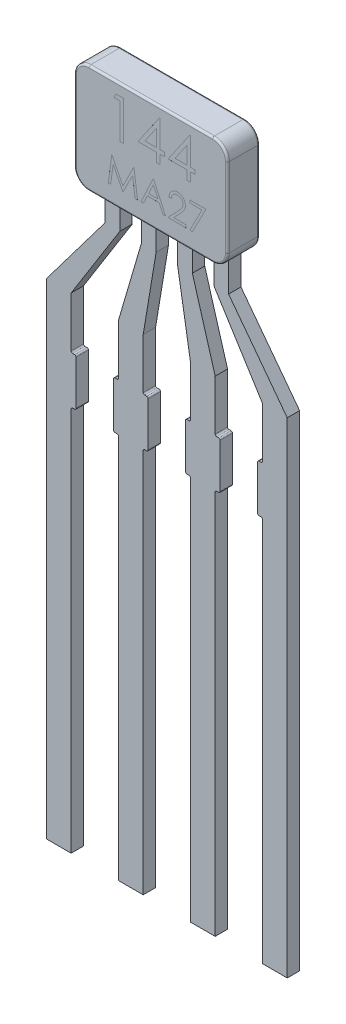
from build123d import *

# Parameters (mm, degrees)
BOSS_EXTRUDE1_DEPTH = 0.325
FILLET1_R           = 0.04
SKETCH2_W           = 2.5
SKETCH2_H           = 0.49680622
CUT_EXTRUDE1_DEPTH  = 0.4
BOSS_EXTRUDE2_DEPTH = 0.25
CUT_EXTRUDE2_DEPTH  = 0.0001


with BuildPart() as part:
    # Sketch1 → Boss-Extrude1 (new, symmetric)
    with BuildSketch(Plane.XY):
        with BuildLine():
            Line((-1.25, 1.1), (1.25, 1.1))
            ThreePointArc((1.25, 1.1), (1.462132034, 1.012132034), (1.55, 0.8))
            Line((1.55, 0.8), (1.55, -0.8))
            ThreePointArc((1.55, -0.8), (1.462132034, -1.012132034), (1.25, -1.1))
            Line((1.25, -1.1), (-1.25, -1.1))
            ThreePointArc((-1.25, -1.1), (-1.462132034, -1.012132034), (-1.55, -0.8))
            Line((-1.55, -0.8), (-1.55, 0.8))
            ThreePointArc((-1.55, 0.8), (-1.462132034, 1.012132034), (-1.25, 1.1))
        make_face()
    extrude(amount=BOSS_EXTRUDE1_DEPTH, both=True)

    # Fillet1
    fillet1_edges = [part.edges().sort_by_distance(p)[0] for p in [
        (1.462132034, -1.012132034, 0.325),
        (0, -1.1, -0.325),
        (-1.462132034, -1.012132034, -0.325),
        (1.55, 0, 0.325),
        (1.462132034, 1.012132034, 0.325),
        (0, 1.1, 0.325),
        (-1.462132034, 1.012132034, 0.325),
        (-1.55, 0, 0.325),
        (-1.462132034, -1.012132034, 0.325),
        (0, -1.1, 0.325),
        (-1.55, 0, -0.325),
        (-1.462132034, 1.012132034, -0.325),
        (0, 1.1, -0.325),
        (1.462132034, 1.012132034, -0.325),
        (1.55, 0, -0.325),
        (1.462132034, -1.012132034, -0.325),
    ]]
    fillet(fillet1_edges, radius=FILLET1_R)

    # Sketch2 → Cut-Extrude1 (cut)
    with BuildSketch(Plane.XZ.offset(1.1)):
        Rectangle(SKETCH2_W, SKETCH2_H)
    extrude(amount=-CUT_EXTRUDE1_DEPTH, mode=Mode.SUBTRACT)

    # Sketch3 → Boss-Extrude2 (add)
    with BuildSketch(Plane.XY.offset(-0.24840311)):
        with BuildLine():
            Line((-1.25, -0.7), (-1.25, -1.813567349))
            Line((-1.25, -1.813567349), (-2.435810925, -3.385995645))
            Line((-2.435810925, -3.385995645), (-2.435810925, -13.2))
            Line((-2.435810925, -13.2), (-1.935810925, -13.2))
            Line((-1.935810925, -13.2), (-1.935810925, -5.417330503))
            ThreePointArc((-1.935810925, -5.417330503), (-1.927024128, -5.3961173), (-1.905810925, -5.387330503))
            Line((-1.905810925, -5.387330503), (-1.865810925, -5.387330503))
            ThreePointArc((-1.865810925, -5.387330503), (-1.844597721, -5.378543706), (-1.835810925, -5.357330503))
            Line((-1.835810925, -5.357330503), (-1.835810925, -4.460635053))
            ThreePointArc((-1.835810925, -4.460635053), (-1.844597721, -4.439421849), (-1.865810925, -4.430635053))
            Line((-1.865810925, -4.430635053), (-1.905810925, -4.430635053))
            ThreePointArc((-1.905810925, -4.430635053), (-1.927024128, -4.421848256), (-1.935810925, -4.400635053))
            Line((-1.935810925, -4.400635053), (-1.935810925, -3.385995645))
            Line((-1.935810925, -3.385995645), (-0.95, -1.813567349))
            Line((-0.95, -1.813567349), (-0.95, -0.7))
            Line((-0.95, -0.7), (-1.25, -0.7))
        make_face()
        with BuildLine():
            Line((-0.5166, -0.7), (-0.5166, -1.813567349))
            Line((-0.5166, -1.813567349), (-0.978, -3.385995645))
            Line((-0.978, -3.385995645), (-0.978, -4.400635053))
            ThreePointArc((-0.978, -4.400635053), (-0.986786797, -4.421848256), (-1.008, -4.430635053))
            Line((-1.008, -4.430635053), (-1.048, -4.430635053))
            ThreePointArc((-1.048, -4.430635053), (-1.069213203, -4.439421849), (-1.078, -4.460635053))
            Line((-1.078, -4.460635053), (-1.078, -5.357330503))
            ThreePointArc((-1.078, -5.357330503), (-1.069213203, -5.378543706), (-1.048, -5.387330503))
            Line((-1.048, -5.387330503), (-1.008, -5.387330503))
            ThreePointArc((-1.008, -5.387330503), (-0.986786797, -5.3961173), (-0.978, -5.417330503))
            Line((-0.978, -5.417330503), (-0.978, -13.2))
            Line((-0.978, -13.2), (-0.478, -13.2))
            Line((-0.478, -13.2), (-0.478, -5.417330503))
            ThreePointArc((-0.478, -5.417330503), (-0.469213203, -5.3961173), (-0.448, -5.387330503))
            Line((-0.448, -5.387330503), (-0.408, -5.387330503))
            ThreePointArc((-0.408, -5.387330503), (-0.386786797, -5.378543706), (-0.378, -5.357330503))
            Line((-0.378, -5.357330503), (-0.378, -4.460635053))
            ThreePointArc((-0.378, -4.460635053), (-0.386786797, -4.439421849), (-0.408, -4.430635053))
            Line((-0.408, -4.430635053), (-0.448, -4.430635053))
            ThreePointArc((-0.448, -4.430635053), (-0.469213203, -4.421848256), (-0.478, -4.400635053))
            Line((-0.478, -4.400635053), (-0.478, -3.385995645))
            Line((-0.478, -3.385995645), (-0.2166, -1.813567349))
            Line((-0.2166, -1.813567349), (-0.2166, -0.7))
            Line((-0.2166, -0.7), (-0.5166, -0.7))
        make_face()
    boss_extrude2 = extrude(amount=BOSS_EXTRUDE2_DEPTH)

    # Mirror1: Boss-Extrude2 across plane
    add(boss_extrude2.mirror(Plane(origin=(0, 0, 0), x_dir=(0, 0, 1), z_dir=(1, 0, 0))))

    # Sketch4 → Cut-Extrude2 (cut)
    # profile 1 of 7: a face of its own
    with BuildSketch(Plane.XY.offset(0.325)):
        Polygon((-0.70166504, 0.876514531), (-0.554903972, 0.876514531), (-0.554903972, 0.082764531), (-0.626137947, 0.082764531), (-0.626137947, 0.795104275), (-0.748253331, 0.795104275), align=None)
    # profile 2 of 7: a face of its own
    with BuildSketch(Plane.XY.offset(0.325)):
        Polygon((0.173495216, 0.896867096), (0.187964617, 0.896867096), (0.187964617, 0.347347865), (0.279551156, 0.347347865), (0.279551156, 0.265937608), (0.187964617, 0.265937608), (0.187964617, 0.082764531), (0.116730643, 0.082764531), (0.116730643, 0.265937608), (-0.259791793, 0.265937608), align=None)
        Polygon((0.116730643, 0.347347865), (0.116730643, 0.692069419), (-0.119867915, 0.347347865), align=None, mode=Mode.SUBTRACT)
    # profile 3 of 7: a face of its own
    with BuildSketch(Plane.XY.offset(0.325)):
        Polygon((0.784072139, 0.896867096), (0.79854154, 0.896867096), (0.79854154, 0.347347865), (0.890128079, 0.347347865), (0.890128079, 0.265937608), (0.79854154, 0.265937608), (0.79854154, 0.082764531), (0.727307566, 0.082764531), (0.727307566, 0.265937608), (0.35078513, 0.265937608), align=None)
        Polygon((0.727307566, 0.347347865), (0.727307566, 0.692069419), (0.490709008, 0.347347865), align=None, mode=Mode.SUBTRACT)
    # profile 4 of 7: a face of its own
    with BuildSketch(Plane.XY.offset(0.325)):
        Polygon((-0.860192434, -0.761065582), (-0.790336498, -0.231898915), (-0.78355231, -0.231898915), (-0.565080255, -0.66608695), (-0.347138214, -0.231898915), (-0.340248023, -0.231898915), (-0.269968075, -0.761065582), (-0.317669397, -0.761065582), (-0.368338802, -0.380303029), (-0.559356096, -0.761065582), (-0.570062393, -0.761065582), (-0.761821708, -0.379455005), (-0.812385109, -0.761065582), align=None)
    # profile 5 of 7: a face of its own
    with BuildSketch(Plane.XY.offset(0.325)):
        Polygon((0.055672951, -0.231898915), (0.29990372, -0.761065582), (0.248280289, -0.761065582), (0.170050121, -0.591460881), (-0.069834528, -0.591460881), (-0.150290758, -0.761065582), (-0.202126195, -0.761065582), (0.048888763, -0.231898915), align=None)
        Polygon((0.051750842, -0.335039774), (-0.044075814, -0.537187377), (0.145033427, -0.537187377), align=None, mode=Mode.SUBTRACT)
    # profile 6 of 7: a face of its own
    with BuildSketch(Plane.XY.offset(0.325)):
        with BuildLine():
            Line((0.415234916, -0.394719428), (0.3677456, -0.394719428))
            add(Edge.make_bspline(
                [(0.3677456, -0.394719428), (0.36805511, -0.388419187), (0.36866298, -0.376045681), (0.371509638, -0.358005042), (0.375582842, -0.340761043), (0.381341907, -0.324452139), (0.388494165, -0.308934129), (0.397071205, -0.294268651), (0.407230276, -0.280511649), (0.418752008, -0.267790658), (0.431265838, -0.256120632), (0.444768045, -0.246042994), (0.45895652, -0.237528299), (0.473788215, -0.230410063), (0.489430467, -0.225067015), (0.505741327, -0.221102553), (0.522792459, -0.21871732), (0.534409938, -0.218460933), (0.540318383, -0.218330539)],
                knots=[0, 0, 0, 0, 1.10065271, 2.161652631, 3.183658789, 4.190468796, 5.17591951, 6.163126047, 7.15150782, 8.156236427, 9.156009102, 10.134482811, 11.092018607, 12.041330605, 13.001268258, 13.972401359, 14.968799086, 16, 16, 16, 16], degree=3))
            add(Edge.make_bspline(
                [(0.540318383, -0.218330539), (0.546120783, -0.218466377), (0.55752229, -0.218733294), (0.574162618, -0.221025498), (0.590003947, -0.224615605), (0.605015312, -0.229652579), (0.619076943, -0.236423557), (0.632294475, -0.244557233), (0.644825264, -0.253964279), (0.656105099, -0.265039558), (0.666462868, -0.276863014), (0.675398567, -0.289485589), (0.683050795, -0.302522636), (0.68942917, -0.316073567), (0.694124563, -0.330265972), (0.697689363, -0.344893228), (0.699704341, -0.360106741), (0.70001359, -0.370403804), (0.700170814, -0.375638899)],
                knots=[0, 0, 0, 0, 1.111607364, 2.184268762, 3.212621178, 4.221274766, 5.211760367, 6.196651075, 7.1921475, 8.207485113, 9.220403448, 10.201281604, 11.166441695, 12.114753415, 13.065576456, 14.026450734, 14.996634279, 16, 16, 16, 16], degree=3))
            add(Edge.make_bspline(
                [(0.700170814, -0.375638899), (0.699914809, -0.383009108), (0.699407291, -0.397620188), (0.69506595, -0.419091482), (0.688285585, -0.439894297), (0.680121699, -0.456636722), (0.671885984, -0.470127977), (0.664464421, -0.481235745), (0.655776288, -0.493195739), (0.645695135, -0.505967908), (0.634429498, -0.519652294), (0.621877338, -0.534240633), (0.607949144, -0.549582198), (0.598173395, -0.560060545), (0.593107846, -0.565490161)],
                knots=[0, 0, 0, 0, 1.184426356, 2.348067706, 3.509069118, 4.696110526, 5.333549288, 6.050745305, 6.844228056, 7.710549037, 8.667450064, 9.695053472, 10.805634456, 12, 12, 12, 12], degree=3))
            Line((0.593107846, -0.565490161), (0.460710177, -0.706792078))
            Line((0.460710177, -0.706792078), (0.706955002, -0.706792078))
            Line((0.706955002, -0.706792078), (0.706955002, -0.761065582))
            Line((0.706955002, -0.761065582), (0.347393036, -0.761065582))
            Line((0.347393036, -0.761065582), (0.552614724, -0.542063512))
            add(Edge.make_bspline(
                [(0.552614724, -0.542063512), (0.55761125, -0.536847697), (0.567208553, -0.526829183), (0.580782824, -0.512202569), (0.592974671, -0.498633293), (0.603863015, -0.486146993), (0.613211652, -0.47456103), (0.621507811, -0.46425064), (0.628154989, -0.454762765), (0.635369103, -0.443765077), (0.642356217, -0.4303375), (0.648360347, -0.41392824), (0.652021401, -0.397036144), (0.652460585, -0.385620955), (0.652681498, -0.379879017)],
                knots=[0, 0, 0, 0, 1.329631726, 2.553950428, 3.673215718, 4.687767853, 5.603093632, 6.413772471, 7.123043292, 7.734684054, 8.834405432, 9.900288307, 10.943827018, 12, 12, 12, 12], degree=3))
            add(Edge.make_bspline(
                [(0.652681498, -0.379879017), (0.652585379, -0.376268377), (0.652395949, -0.369152499), (0.65072413, -0.358719485), (0.648197661, -0.348655519), (0.644577366, -0.338929645), (0.639798728, -0.329639647), (0.633981919, -0.320774219), (0.627270565, -0.312203387), (0.619506742, -0.304167115), (0.610977857, -0.29680698), (0.601967774, -0.290287029), (0.592435199, -0.284838259), (0.582420323, -0.280371563), (0.571951068, -0.276867666), (0.561007184, -0.274439762), (0.54961891, -0.272915387), (0.541842655, -0.272709137), (0.537880316, -0.272604044)],
                knots=[0, 0, 0, 0, 0.991446411, 1.95395049, 2.89581595, 3.838931463, 4.798493298, 5.75982156, 6.748411868, 7.785213223, 8.824556874, 9.840280684, 10.836137867, 11.835679398, 12.848801643, 13.863922112, 14.911575587, 16, 16, 16, 16], degree=3))
            add(Edge.make_bspline(
                [(0.537880316, -0.272604044), (0.533742106, -0.27271215), (0.525615347, -0.272924452), (0.513683541, -0.274409545), (0.502301048, -0.276971595), (0.491439237, -0.280475688), (0.481079728, -0.28492954), (0.471272902, -0.290476982), (0.462040775, -0.297096629), (0.453365991, -0.304601808), (0.445373461, -0.312957743), (0.438351135, -0.322272583), (0.432215219, -0.332376252), (0.42686168, -0.343241487), (0.422514094, -0.35496688), (0.419191963, -0.367510807), (0.416563237, -0.380818802), (0.415685044, -0.390008928), (0.415234916, -0.394719428)],
                knots=[0, 0, 0, 0, 1.031018746, 2.02475058, 2.990194455, 3.934040569, 4.864654155, 5.795059489, 6.735614925, 7.690564532, 8.649604399, 9.611025574, 10.590972636, 11.591080095, 12.624614302, 13.701020113, 14.821632451, 16, 16, 16, 16], degree=3))
        make_face()
    # profile 7 of 7: a face of its own
    with BuildSketch(Plane.XY.offset(0.325)):
        Polygon((0.788365258, -0.231898915), (1.114006284, -0.231898915), (0.835854575, -0.774633958), (0.794831438, -0.752055332), (1.033656057, -0.28617242), (0.788365258, -0.28617242), align=None)
    extrude(amount=-CUT_EXTRUDE2_DEPTH, mode=Mode.SUBTRACT)


solid = part.part
